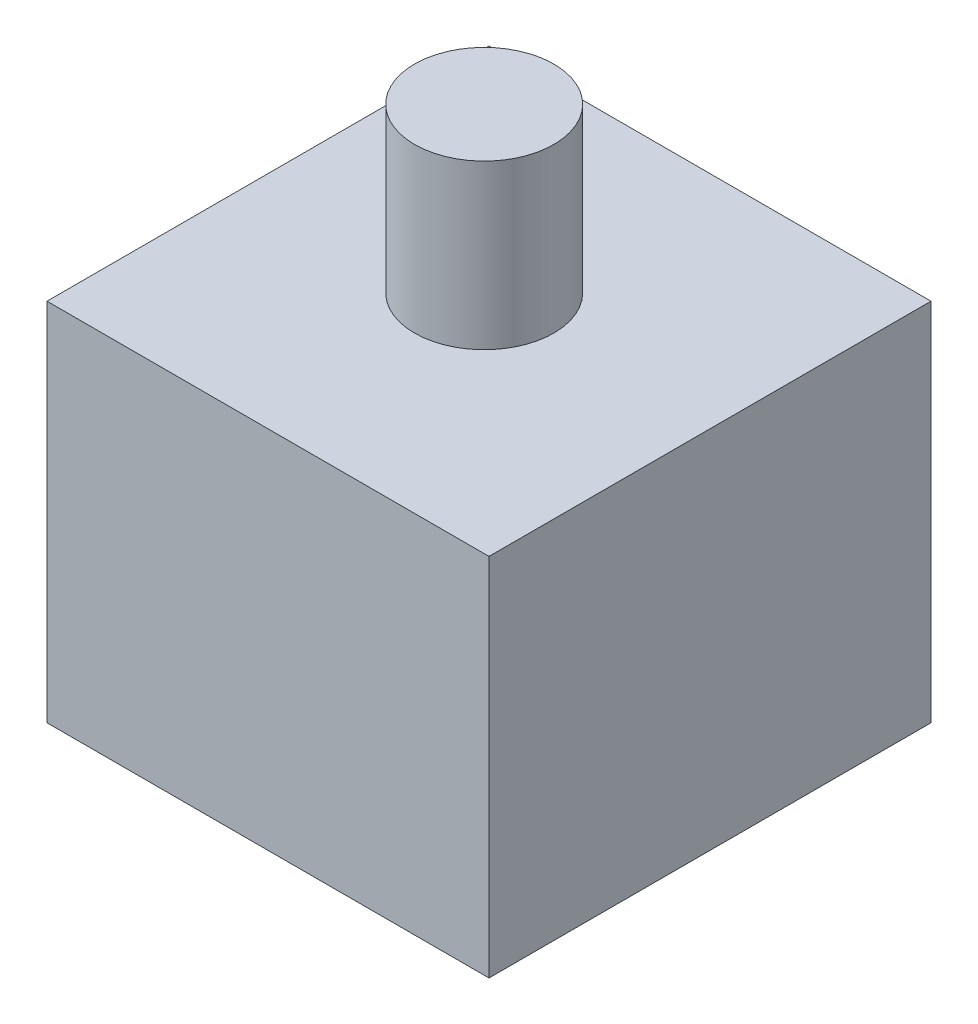
from build123d import *

# Parameters (mm, degrees)
ESQUISSE1_W        = 46
ESQUISSE1_H        = 46
BOSS_EXTRU_1_DEPTH = 38
ESQUISSE2_R        = 7.25
BOSS_EXTRU_2_DEPTH = 17


with BuildPart() as part:
    # Esquisse1 → Boss.-Extru.1 (new body)
    with BuildSketch(Plane(origin=(0, 0, 0), x_dir=(1, 0, 0), z_dir=(0, 1, 0))):
        with Locations((-54.433333333, 4.063333333)):
            Rectangle(ESQUISSE1_W, ESQUISSE1_H)
    extrude(amount=BOSS_EXTRU_1_DEPTH)

    # Esquisse2 → Boss.-Extru.2 (add)
    with BuildSketch(Plane(origin=(0, 38, 0), x_dir=(1, 0, 0), z_dir=(0, 1, 0))):
        with Locations(Location((-55.433333333, 4.563333333, 0), (0, 0, 270))):
            Circle(ESQUISSE2_R)
    extrude(amount=BOSS_EXTRU_2_DEPTH)


solid = part.part
